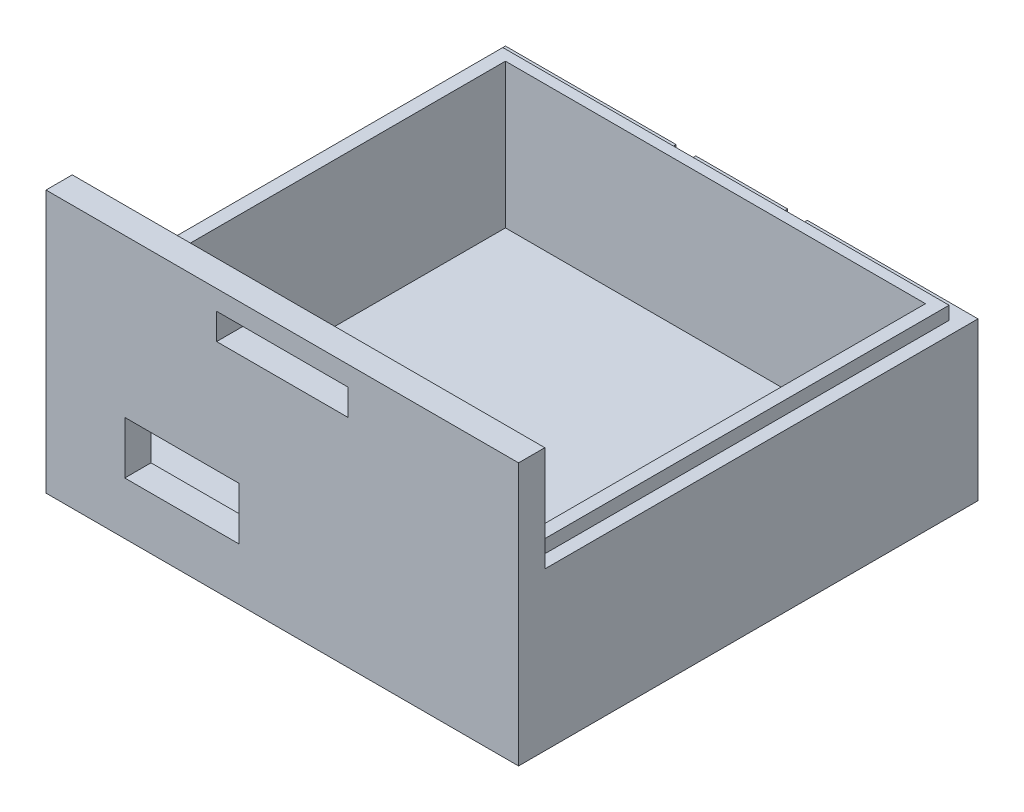
from build123d import *

# Parameters (mm, degrees)
CROQUIS1_W              = 36
CROQUIS1_H              = 35
SALIENTE_EXTRUIR1_DEPTH = 20
CROQUIS2_W              = 36
CROQUIS2_H              = 33
CORTAR_EXTRUIR1_DEPTH   = 7
CROQUIS3_W              = 32
CROQUIS3_H              = 31
CORTAR_EXTRUIR2_DEPTH   = 11
CORTAR_EXTRUIR3_REACH   = 46.147
CROQUIS4_W              = 8.7
CROQUIS4_H              = 4
CORTAR_EXTRUIR4_REACH   = 46.147
CROQUIS5_W              = 10
CROQUIS5_H              = 1
CROQUIS6_W              = 10
CROQUIS6_H              = 1
CORTAR_EXTRUIR5_DEPTH   = 1
CORTAR_EXTRUIR6_DEPTH   = 1
CORTAR_EXTRUIR7_DEPTH   = 1.2


with BuildPart() as part:
    # Croquis1 → Saliente-Extruir1 (new body)
    with BuildSketch(Plane(origin=(0, 0, 0), x_dir=(1, 0, 0), z_dir=(0, 1, 0))):
        Rectangle(CROQUIS1_W, CROQUIS1_H)
    extrude(amount=SALIENTE_EXTRUIR1_DEPTH)

    # Croquis2 → Cortar-Extruir1 (cut)
    with BuildSketch(Plane(origin=(0, 20, 0), x_dir=(1, 0, 0), z_dir=(0, 1, 0))):
        with Locations((0, 1)):
            Rectangle(CROQUIS2_W, CROQUIS2_H)
    extrude(amount=-CORTAR_EXTRUIR1_DEPTH, mode=Mode.SUBTRACT)

    # Croquis3 → Cortar-Extruir2 (cut)
    with BuildSketch(Plane(origin=(0, 13, 0), x_dir=(1, 0, 0), z_dir=(0, 1, 0))):
        Rectangle(CROQUIS3_W, CROQUIS3_H)
    extrude(amount=-CORTAR_EXTRUIR2_DEPTH, mode=Mode.SUBTRACT)

    # Croquis4 → Cortar-Extruir3 (cut, up to next)
    with BuildSketch(Plane.XY.offset(17.5), mode=Mode.PRIVATE) as cortar_extruir3_sk1:
        with Locations((-7.65, 6)):
            Rectangle(CROQUIS4_W, CROQUIS4_H)
    cortar_extruir3_tool1 = extrude(cortar_extruir3_sk1.sketch, amount=-CORTAR_EXTRUIR3_REACH, mode=Mode.PRIVATE) & part.part
    add(cortar_extruir3_tool1.solids().sort_by_distance((-7.65, 6, 17.5))[0], mode=Mode.SUBTRACT)

    # Croquis5 → Cortar-Extruir4 (cut, up to next)
    with BuildSketch(Plane.XY.offset(17.5), mode=Mode.PRIVATE) as cortar_extruir4_sk1:
        with Locations((0, 17)):
            Rectangle(CROQUIS5_W, CROQUIS5_H)
    cortar_extruir4_tool1 = extrude(cortar_extruir4_sk1.sketch, amount=-CORTAR_EXTRUIR4_REACH, mode=Mode.PRIVATE) & part.part
    add(cortar_extruir4_tool1.solids().sort_by_distance((0, 17, 17.5))[0], mode=Mode.SUBTRACT)

    # Croquis6 → Cortar-Extruir5 (cut)
    with BuildSketch(Plane.XY.offset(17.5)):
        with Locations((0, 18)):
            Rectangle(CROQUIS6_W, CROQUIS6_H)
    extrude(amount=-CORTAR_EXTRUIR5_DEPTH, mode=Mode.SUBTRACT)

    # Croquis7 → Cortar-Extruir6 (cut)
    with BuildSketch(Plane(origin=(0, 13, 0), x_dir=(1, 0, 0), z_dir=(0, 1, 0))):
        Polygon((-18, -15.5), (-17, -15.5), (-17, 16.3), (17, 16.3), (17, -15.5), (18, -15.5), (18, 17.5), (-18, 17.5), align=None)
    extrude(amount=-CORTAR_EXTRUIR6_DEPTH, mode=Mode.SUBTRACT)

    # Croquis8 → Cortar-Extruir7 (cut)
    with BuildSketch(Plane(origin=(0, 0, -17.5), x_dir=(-1, 0, 0), z_dir=(0, 0, -1))):
        Polygon((-5, 12), (-5, 7), (5, 7), (5, 12), (3.5, 12), (3.5, 9), (-3.5, 9), (-3.5, 12), align=None)
    extrude(amount=-CORTAR_EXTRUIR7_DEPTH, mode=Mode.SUBTRACT)


solid = part.part
